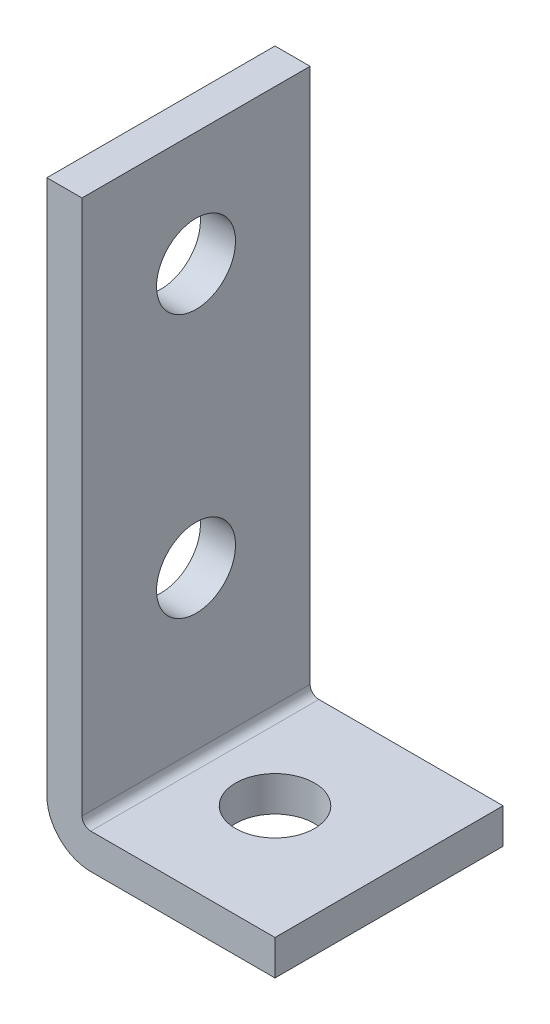
from build123d import *

# Parameters (mm, degrees)
EXTRUDE_THIN1_DEPTH = 20.6375
SKETCH2_R           = 7.14375
CUT_EXTRUDE1_DEPTH  = 109.706083805
SKETCH3_R           = 7.14375
CUT_EXTRUDE2_DEPTH  = 113.354183973


with BuildPart() as part:
    # Sketch1 → Extrude-Thin1 (new, symmetric)
    with BuildSketch(Plane.XY):
        with BuildLine():
            Line((0, 104.775), (0, 7.9375))
            ThreePointArc((0, 7.9375), (2.324839924, 2.324839924), (7.9375, 0))
            Line((7.9375, 0), (41.275, 0))
            Line((41.275, 0), (41.275, 6.35))
            Line((41.275, 6.35), (7.9375, 6.35))
            ThreePointArc((7.9375, 6.35), (6.814967985, 6.814967985), (6.35, 7.9375))
            Line((6.35, 7.9375), (6.35, 104.775))
            Line((6.35, 104.775), (0, 104.775))
        make_face()
    extrude(amount=EXTRUDE_THIN1_DEPTH, both=True)

    # Sketch2 → Cut-Extrude1 (cut, through all)
    with BuildSketch(Plane(origin=(0, 6.35, 0), x_dir=(1, 0, 0), z_dir=(0, 1, 0))):
        with Locations(Location((20.6375, 0, 0), (0, 0, 270))):
            Circle(SKETCH2_R)
    extrude(amount=-CUT_EXTRUDE1_DEPTH, mode=Mode.SUBTRACT)

    # Sketch3 → Cut-Extrude2 (cut, through all)
    with BuildSketch(Plane(origin=(6.35, 0, 0), x_dir=(0, 0, -1), z_dir=(1, 0, 0))):
        with Locations(Location((0, 84.1375, 0), (0, 0, 90))):
            Circle(SKETCH3_R)
        with Locations(Location((0, 36.5125, 0), (0, 0, 90))):
            Circle(SKETCH3_R)
    extrude(amount=-CUT_EXTRUDE2_DEPTH, mode=Mode.SUBTRACT)


solid = part.part
